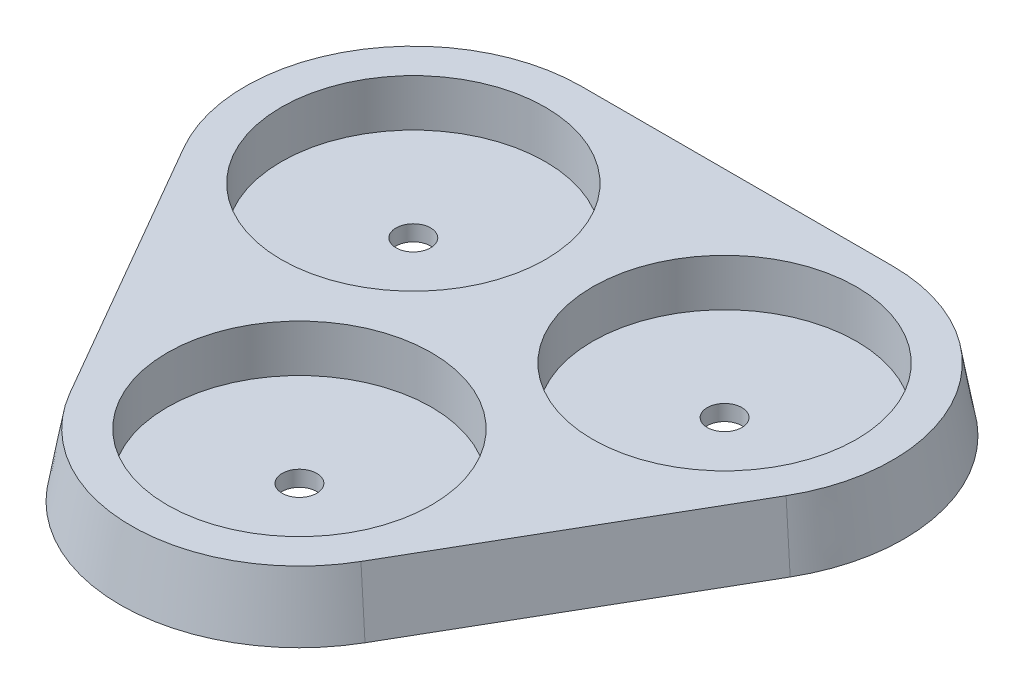
from build123d import *

# Parameters (mm, degrees)
BOSS_EXTRUDE1_DEPTH = 4
BOSS_EXTRUDE1_TAPER = 10
CUT_EXTRUDE1_START  = 4
SKETCH1_3_R         = 1.1
CUT_EXTRUDE1_DEPTH  = 4
CUT_EXTRUDE2_START  = 4
SKETCH1_4_R         = 8.4
SKETCH1_4_R_2       = 1.1
CUT_EXTRUDE2_DEPTH  = 3


with BuildPart() as part:
    # Sketch1 → Boss-Extrude1 (new body)
    with BuildSketch(Plane(origin=(0, 0, 0), x_dir=(1, 0, 0), z_dir=(0, 1, 0))):
        with BuildLine():
            Line((-29.672689603, -5.7), (-19.772689603, -22.847302995))
            ThreePointArc((-19.772689603, -22.847302995), (-9.9, -28.547302995), (-0.027310397, -22.847302995))
            Line((-0.027310397, -22.847302995), (9.872689603, -5.7))
            ThreePointArc((9.872689603, -5.7), (9.872689603, 5.7), (0, 11.4))
            Line((0, 11.4), (-19.8, 11.4))
            ThreePointArc((-19.8, 11.4), (-29.672689603, 5.7), (-29.672689603, -5.7))
        make_face()
    extrude(amount=BOSS_EXTRUDE1_DEPTH, taper=BOSS_EXTRUDE1_TAPER)

    # Sketch1<3> → Cut-Extrude1 (cut)
    with BuildSketch(Plane(origin=(0, 0, 0), x_dir=(1, 0, 0), z_dir=(0, 1, 0)).offset(CUT_EXTRUDE1_START)):
        with Locations(Location((-9.9, -17.147302995, 0), (0, 0, 270))):
            Circle(SKETCH1_3_R)
        with Locations(Location((0, 0, 0), (0, 0, 270))):
            Circle(SKETCH1_3_R)
        with Locations(Location((-19.8, 0, 0), (0, 0, 270))):
            Circle(SKETCH1_3_R)
    extrude(amount=-CUT_EXTRUDE1_DEPTH, mode=Mode.SUBTRACT)

    # Sketch1<4> → Cut-Extrude2 (cut)
    # profile 1 of 3: a face of its own
    with BuildSketch(Plane(origin=(0, 0, 0), x_dir=(1, 0, 0), z_dir=(0, 1, 0)).offset(CUT_EXTRUDE2_START)):
        with Locations(Location((-19.8, 0, 0), (0, 0, 270))):
            Circle(SKETCH1_4_R)
        with Locations(Location((-19.8, 0, 0), (0, 0, 270))):
            Circle(SKETCH1_4_R_2, mode=Mode.SUBTRACT)
    # profile 2 of 3: a face of its own
    with BuildSketch(Plane(origin=(0, 0, 0), x_dir=(1, 0, 0), z_dir=(0, 1, 0)).offset(CUT_EXTRUDE2_START)):
        with Locations(Location((-9.9, -17.147302995, 0), (0, 0, 270))):
            Circle(SKETCH1_4_R)
        with Locations(Location((-9.9, -17.147302995, 0), (0, 0, 270))):
            Circle(SKETCH1_4_R_2, mode=Mode.SUBTRACT)
    # profile 3 of 3: a face of its own
    with BuildSketch(Plane(origin=(0, 0, 0), x_dir=(1, 0, 0), z_dir=(0, 1, 0)).offset(CUT_EXTRUDE2_START)):
        with Locations(Location((0, 0, 0), (0, 0, 270))):
            Circle(SKETCH1_4_R)
        with Locations(Location((0, 0, 0), (0, 0, 270))):
            Circle(SKETCH1_4_R_2, mode=Mode.SUBTRACT)
    extrude(amount=-CUT_EXTRUDE2_DEPTH, mode=Mode.SUBTRACT)


solid = part.part
